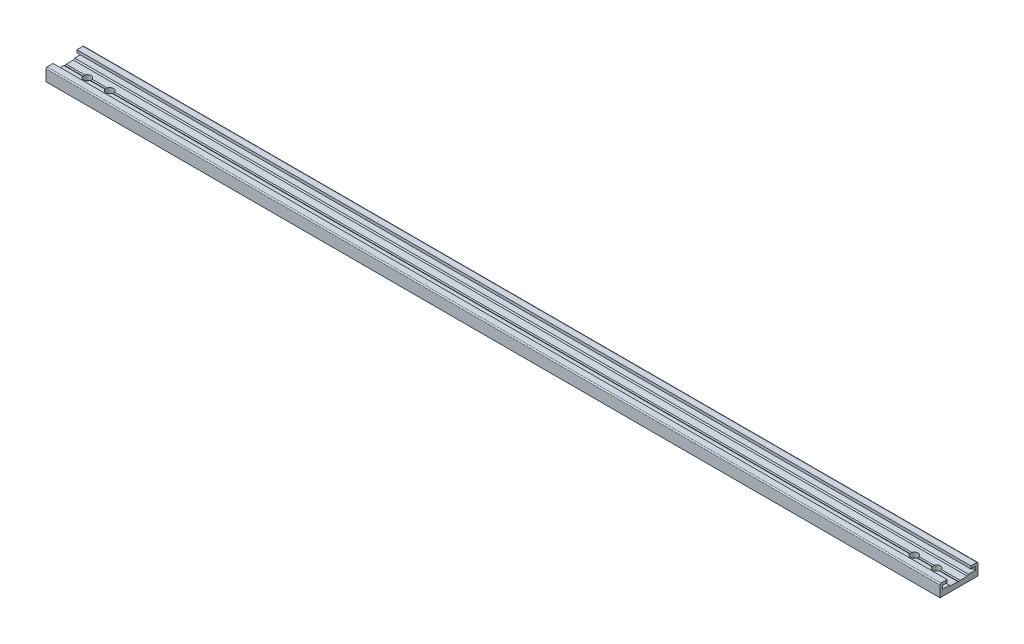
from build123d import *

# Parameters (mm, degrees)
BOSS_EXTRUDE1_DEPTH  = 400
M3_CLEARANCE_HOLE1_D = 3.4


with BuildPart() as part:
    # Sketch5 → Boss-Extrude1 (new body)
    with BuildSketch(Plane(origin=(0, 0, 0), x_dir=(0, 0, -1), z_dir=(1, 0, 0))):
        with BuildLine():
            Line((-8.499999996, -2.75), (8.499999996, -2.75))
            Line((8.499999996, -2.75), (8.499999996, 2.25))
            ThreePointArc((8.499999996, 2.25), (8.353553387, 2.603553391), (7.999999996, 2.75))
            Line((7.999999996, 2.75), (5.299999996, 2.75))
            Line((5.299999996, 2.75), (5.299999996, 1.55))
            Line((5.299999996, 1.55), (7.299999998, 1.55))
            Line((7.299999998, 1.55), (7.299999998, 0.05))
            Line((7.299999998, 0.05), (4.249999998, 0.05))
            Line((4.249999998, 0.05), (3.749999998, -0.45))
            Line((3.749999998, -0.45), (0.499999998, -0.45))
            Line((0.499999998, -0.45), (0, -0.738675133))
            Line((0, -0.738675133), (-0.499999998, -0.45))
            Line((-0.499999998, -0.45), (-3.749999998, -0.45))
            Line((-3.749999998, -0.45), (-4.249999998, 0.05))
            Line((-4.249999998, 0.05), (-7.299999998, 0.05))
            Line((-7.299999998, 0.05), (-7.299999998, 1.55))
            Line((-7.299999998, 1.55), (-5.299999996, 1.55))
            Line((-5.299999996, 1.55), (-5.299999996, 2.75))
            Line((-5.299999996, 2.75), (-7.999999996, 2.75))
            ThreePointArc((-7.999999996, 2.75), (-8.353553387, 2.603553391), (-8.499999996, 2.25))
            Line((-8.499999996, 2.25), (-8.499999996, -2.75))
        make_face()
    extrude(amount=BOSS_EXTRUDE1_DEPTH)

    # M3 Clearance Hole1 (through all)
    with Locations(Plane(origin=(0, -2.75, 0), x_dir=(-1, 0, 0), z_dir=(0, -1, 0))):
        with Locations((-390, 0), (-380, 0), (-10, 0), (-20, 0)):
            Hole(M3_CLEARANCE_HOLE1_D / 2)


solid = part.part
